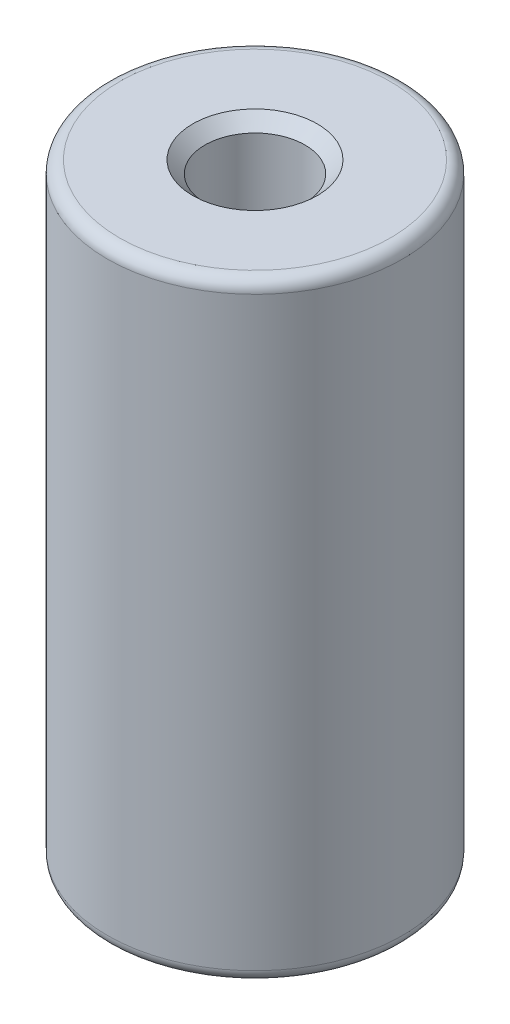
from build123d import *

# Parameters (mm, degrees)
SKETCH1_R           = 6.05
SKETCH1_R_2         = 2.05
BOSS_EXTRUDE1_DEPTH = 25
CHAMFER1_SIZE       = 0.5
FILLET1_R           = 0.5


with BuildPart() as part:
    # Sketch1 → Boss-Extrude1 (new body)
    with BuildSketch(Plane(origin=(0, 0, 0), x_dir=(1, 0, 0), z_dir=(0, 1, 0))):
        with Locations(Location((0, 0, 0), (0, 0, 270))):
            Circle(SKETCH1_R)
        with Locations(Location((0, 0, 0), (0, 0, 270))):
            Circle(SKETCH1_R_2, mode=Mode.SUBTRACT)
    extrude(amount=BOSS_EXTRUDE1_DEPTH)

    # Chamfer1
    chamfer1_edges = [part.edges().sort_by_distance(p)[0] for p in [
        (0, 0, -2.05),
        (0, 25, -2.05),
    ]]
    chamfer(chamfer1_edges, length=CHAMFER1_SIZE)

    # Fillet1
    fillet1_edges = [part.edges().sort_by_distance(p)[0] for p in [
        (0, 0, -6.05),
        (0, 25, -6.05),
    ]]
    fillet(fillet1_edges, radius=FILLET1_R)


solid = part.part
